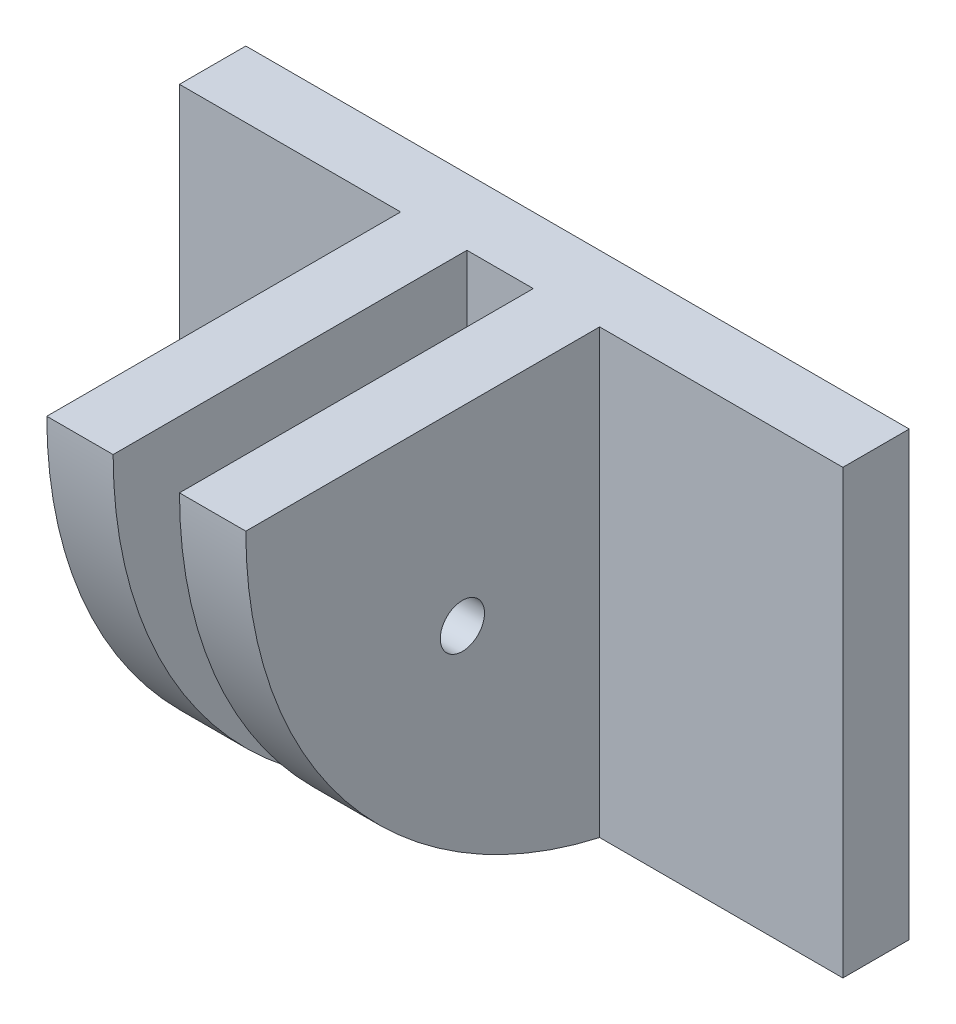
from build123d import *

# Parameters (mm, degrees)
IZIM1_W                     = 30
IZIM1_H                     = 20
Y_KSEKLIK_EKSTR_ZYON1_DEPTH = 3
Y_KSEKLIK_EKSTR_ZYON2_START = -10
Y_KSEKLIK_EKSTR_ZYON2_DEPTH = 3
Y_KSEKLIK_EKSTR_ZYON3_START = -16
Y_KSEKLIK_EKSTR_ZYON3_DEPTH = 3
IZIM3_R                     = 1
KES_EKSTR_ZYON1_DEPTH       = 25


with BuildPart() as part:
    # Çizim1 → Yükseklik-Ekstrüzyon1 (new body)
    with BuildSketch(Plane.XY):
        with Locations((15, 10)):
            Rectangle(IZIM1_W, IZIM1_H)
    extrude(amount=Y_KSEKLIK_EKSTR_ZYON1_DEPTH)

    # Çizim2 → Yükseklik-Ekstrüzyon2 (add)
    with BuildSketch(Plane.ZY.offset(Y_KSEKLIK_EKSTR_ZYON2_START)):
        with BuildLine():
            Line((3, 0), (3, 20))
            Line((3, 20), (19, 20))
            ThreePointArc((19, 20), (14.507810594, 7.193751525), (3, 0))
        make_face()
    extrude(amount=-Y_KSEKLIK_EKSTR_ZYON2_DEPTH)

    # Çizim2<2> → Yükseklik-Ekstrüzyon3 (add)
    with BuildSketch(Plane.ZY.offset(Y_KSEKLIK_EKSTR_ZYON3_START)):
        with BuildLine():
            Line((3, 0), (3, 20))
            Line((3, 20), (19, 20))
            ThreePointArc((19, 20), (14.507810594, 7.193751525), (3, 0))
        make_face()
    extrude(amount=-Y_KSEKLIK_EKSTR_ZYON3_DEPTH)

    # Çizim3 → Kes-Ekstrüzyon1 (cut)
    with BuildSketch(Plane.ZY.offset(-10)):
        with Locations((9.205520774, 11.392083612)):
            Circle(IZIM3_R)
    extrude(amount=-KES_EKSTR_ZYON1_DEPTH, mode=Mode.SUBTRACT)


solid = part.part
